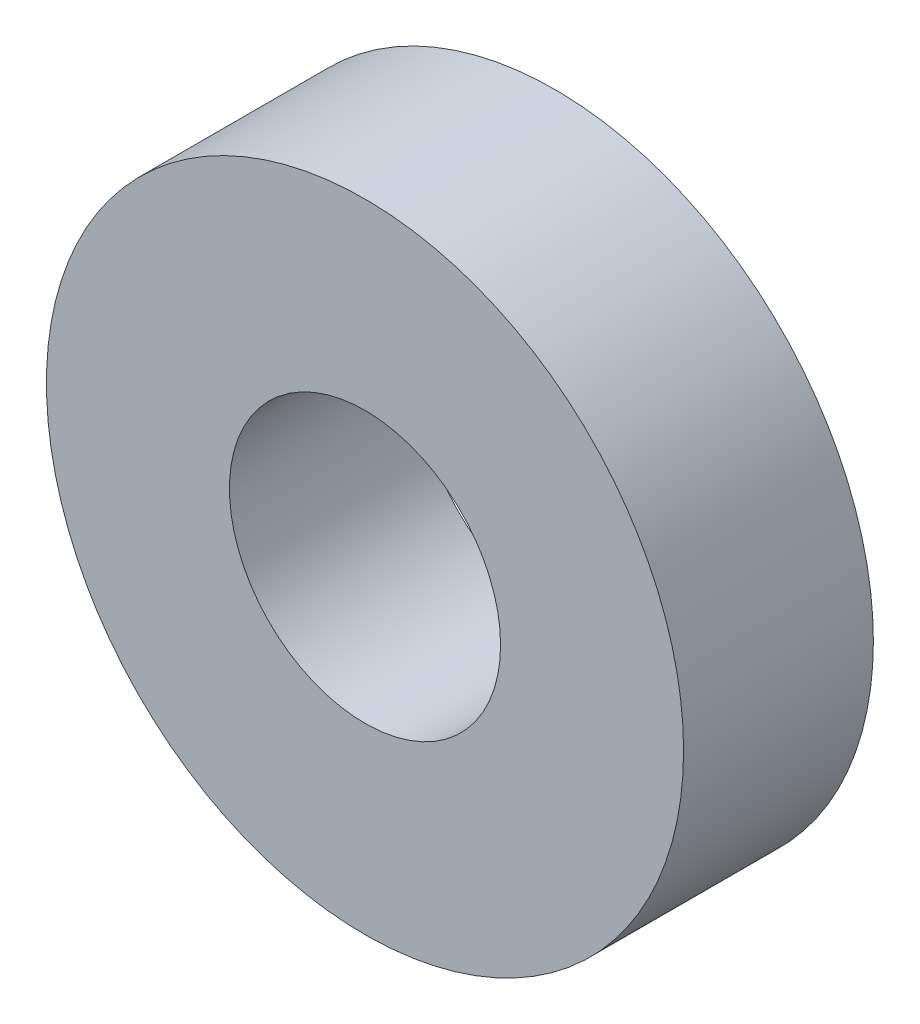
from build123d import *

# Parameters (mm, degrees)
SKETCH2_R           = 23.5
SKETCH2_R_2         = 10
BOSS_EXTRUDE1_DEPTH = 14


with BuildPart() as part:
    # Sketch2 → Boss-Extrude1 (new body)
    with BuildSketch(Plane.XY):
        Circle(SKETCH2_R)
        Circle(SKETCH2_R_2, mode=Mode.SUBTRACT)
    extrude(amount=BOSS_EXTRUDE1_DEPTH)


solid = part.part
